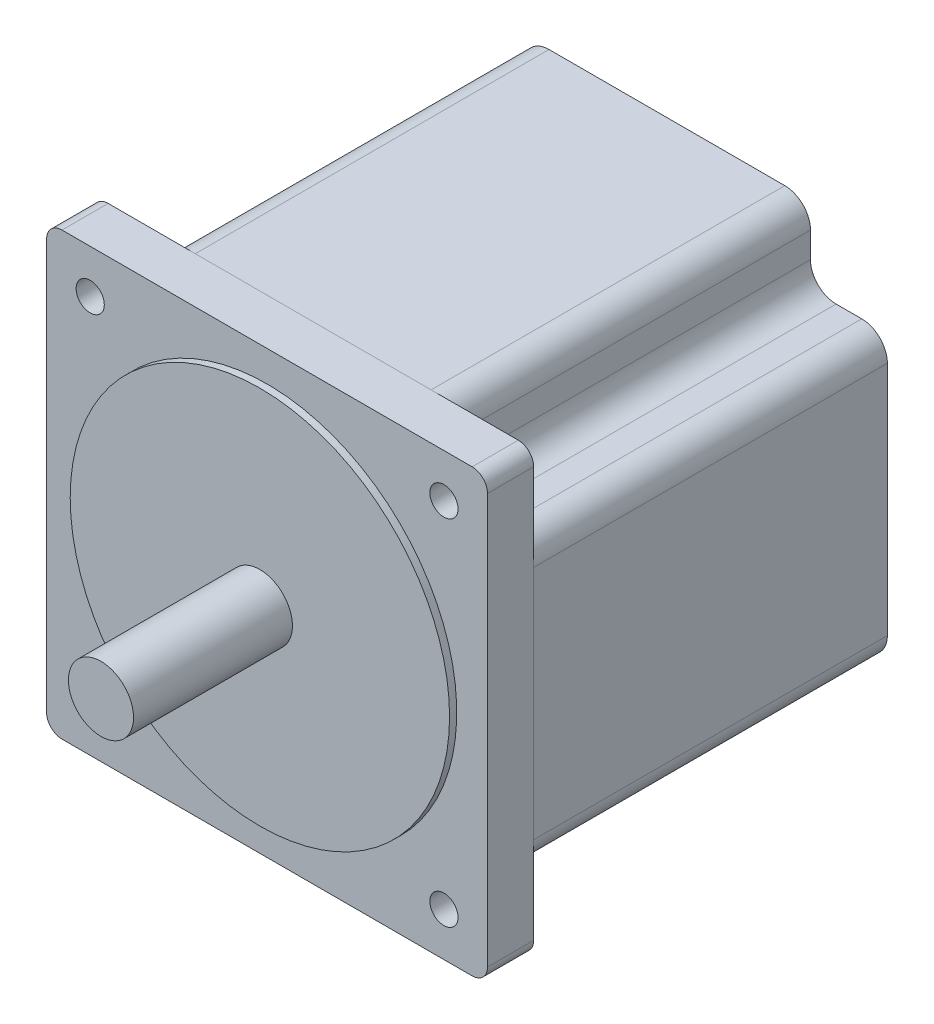
from build123d import *

# Parameters (mm, degrees)
SKETCH_1_W          = 86
SKETCH_1_H          = 86
EXTRUDE_1_DEPTH     = 9
SKETCH_2_W          = 86
SKETCH_2_H          = 86
EXTRUDE_2_DEPTH     = 69
SKETCH_3_R          = 37
EXTRUDE_3_DEPTH     = 1.4
SKETCH_4_R          = 6.35
EXTRUDE_4_DEPTH     = 31
SKETCH_5_R          = 2.75
CUT_EXTRUDE_1_DEPTH = 10
SKETCH_6_W          = 15
SKETCH_6_H          = 15
CUT_EXTRUDE_2_DEPTH = 69
FILLET_1_R          = 5
SKETCH_7_R          = 6.35
CUT_EXTRUDE_3_DEPTH = 1
FILLET_2_R          = 3


with BuildPart() as part:
    # 草图1 → 凸台-拉伸1 (new body)
    with BuildSketch(Plane.XY):
        with Locations((43, 43)):
            Rectangle(SKETCH_1_W, SKETCH_1_H)
    extrude(amount=EXTRUDE_1_DEPTH)

    # 草图3 → 凸台-拉伸3 (add)
    with BuildSketch(Plane.XY.offset(9)):
        with Locations(Location((43, 43, 0), (0, 0, 180))):
            Circle(SKETCH_3_R)
    extrude(amount=EXTRUDE_3_DEPTH)

    # 草图4 → 凸台-拉伸4 (add)
    with BuildSketch(Plane.XY.offset(10.4)):
        with Locations((43, 43)):
            Circle(SKETCH_4_R)
    extrude(amount=EXTRUDE_4_DEPTH)


with BuildPart() as body_2:
    # 草图2 → 凸台-拉伸2 (new body)
    with BuildSketch(Plane(origin=(0, 0, 0), x_dir=(-1, 0, 0), z_dir=(0, 0, -1))):
        with Locations((-43, 43)):
            Rectangle(SKETCH_2_W, SKETCH_2_H)
    extrude(amount=EXTRUDE_2_DEPTH)


with BuildPart() as cut_extrude_1_tool:
    # 草图5 → 切除-拉伸1 (new body)
    with BuildSketch(Plane.XY.offset(9)):
        with Locations((8.5, 77.5)):
            Circle(SKETCH_5_R)
        with Locations(Location((77.5, 77.5, 0), (0, 0, 180))):
            Circle(SKETCH_5_R)
        with Locations((77.5, 8.5)):
            Circle(SKETCH_5_R)
        with Locations(Location((8.5, 8.5, 0), (0, 0, 180))):
            Circle(SKETCH_5_R)
    extrude(amount=-CUT_EXTRUDE_1_DEPTH)


with BuildPart() as part_1:
    add(part.part)

    # 切除-拉伸1: cut by cut_extrude_1_tool
    add(cut_extrude_1_tool.part, mode=Mode.SUBTRACT)

    # 圆角2
    fillet_2_edges = [part_1.edges().sort_by_distance(p)[0] for p in [
        (0, 86, 4.5),
        (86, 86, 4.5),
        (86, 0, 4.5),
        (0, 0, 4.5),
    ]]
    fillet(fillet_2_edges, radius=FILLET_2_R)


with BuildPart() as body_2_1:
    add(body_2.part)

    # 切除-拉伸1: cut by cut_extrude_1_tool
    add(cut_extrude_1_tool.part, mode=Mode.SUBTRACT)

    # 草图6 → 切除-拉伸2 (cut)
    with BuildSketch(Plane(origin=(0, 0, -69), x_dir=(-1, 0, 0), z_dir=(0, 0, -1))):
        with Locations((-78.5, 78.5)):
            Rectangle(SKETCH_6_W, SKETCH_6_H)
        with Locations((-7.5, 78.5)):
            Rectangle(SKETCH_6_W, SKETCH_6_H)
        with Locations((-7.5, 7.5)):
            Rectangle(SKETCH_6_W, SKETCH_6_H)
        with Locations((-78.5, 7.5)):
            Rectangle(SKETCH_6_W, SKETCH_6_H)
    extrude(amount=-CUT_EXTRUDE_2_DEPTH, mode=Mode.SUBTRACT)

    # 圆角1
    fillet_1_edges = [body_2_1.edges().sort_by_distance(p)[0] for p in [
        (86, 71, -34.5),
        (71, 86, -34.5),
        (71, 71, -34.5),
        (15, 86, -34.5),
        (0, 71, -34.5),
        (15, 71, -34.5),
        (0, 15, -34.5),
        (15, 0, -34.5),
        (15, 15, -34.5),
        (71, 0, -34.5),
        (86, 15, -34.5),
        (71, 15, -34.5),
    ]]
    fillet(fillet_1_edges, radius=FILLET_1_R)

    # 草图7 → 切除-拉伸3 (cut)
    with BuildSketch(Plane(origin=(0, 0, -69), x_dir=(-1, 0, 0), z_dir=(0, 0, -1))):
        with Locations((-43, 43)):
            Circle(SKETCH_7_R)
    extrude(amount=-CUT_EXTRUDE_3_DEPTH, mode=Mode.SUBTRACT)


solid = Compound([part_1.part, body_2_1.part])
